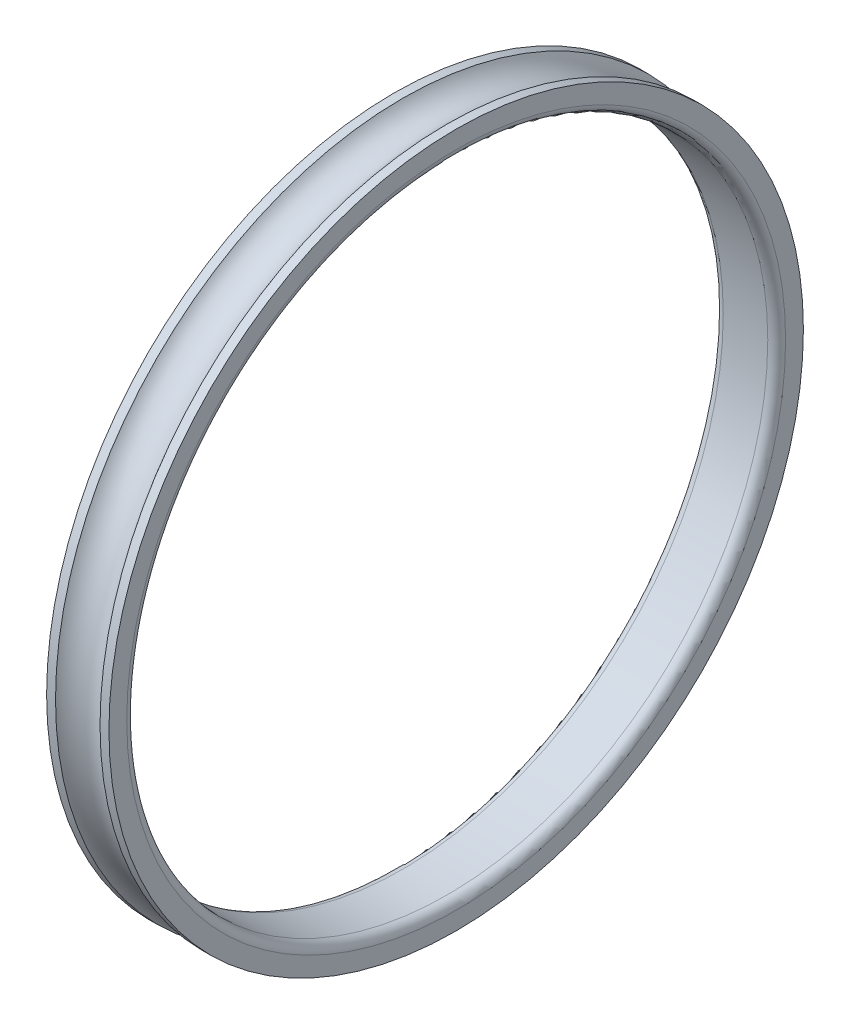
from build123d import *


with BuildPart() as part:
    # Sketch1 → Revolve3 (revolve)
    with BuildSketch(Plane.XY, mode=Mode.PRIVATE) as revolve3_sk:
        with BuildLine():
            Line((31.75, 495.3), (44.45, 495.3))
            Line((44.45, 495.3), (44.45, 469.9))
            ThreePointArc((44.45, 469.9), (40.730256121, 460.919743879), (31.75, 457.2))
            Line((31.75, 457.2), (-31.75, 457.2))
            ThreePointArc((-31.75, 457.2), (-40.730256121, 460.919743879), (-44.45, 469.9))
            Line((-44.45, 469.9), (-44.45, 495.3))
            Line((-44.45, 495.3), (-31.75, 495.3))
            ThreePointArc((-31.75, 495.3), (0, 478.260567419), (31.75, 495.3))
        make_face()
    revolve(revolve3_sk.sketch.rotate(Axis((0, 0, 0), (-1, 0, 0)), 90), axis=Axis((0, 0, 0), (-1, 0, 0)))


solid = part.part
